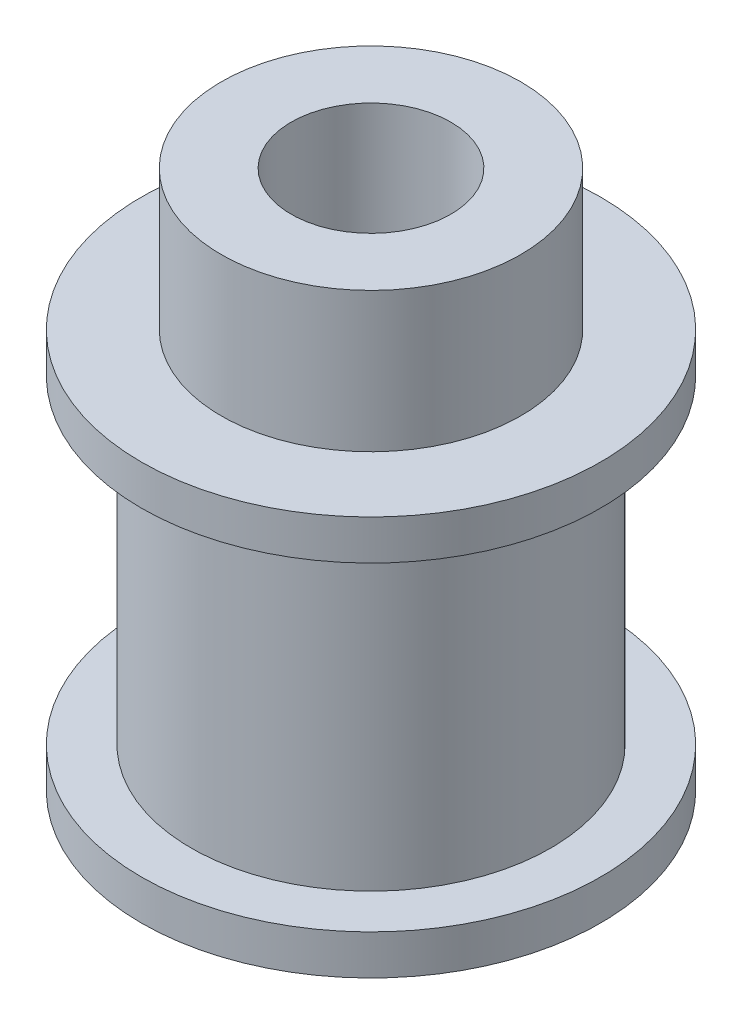
from build123d import *


with BuildPart() as part:
    # Croquis1 → Revolución1 (revolve)
    with BuildSketch(Plane.XY, mode=Mode.PRIVATE) as revoluci_n1_sk:
        Polygon((-4, 0), (-11.5, 0), (-11.5, 2), (-9, 2), (-9, 18), (-11.5, 18), (-11.5, 20), (-7.5, 20), (-7.5, 27), (-4, 27), align=None)
    revolve(revoluci_n1_sk.sketch.rotate(Axis((0, 0, 0), (0, 1, 0)), 270), axis=Axis((0, 0, 0), (0, 1, 0)))


solid = part.part
